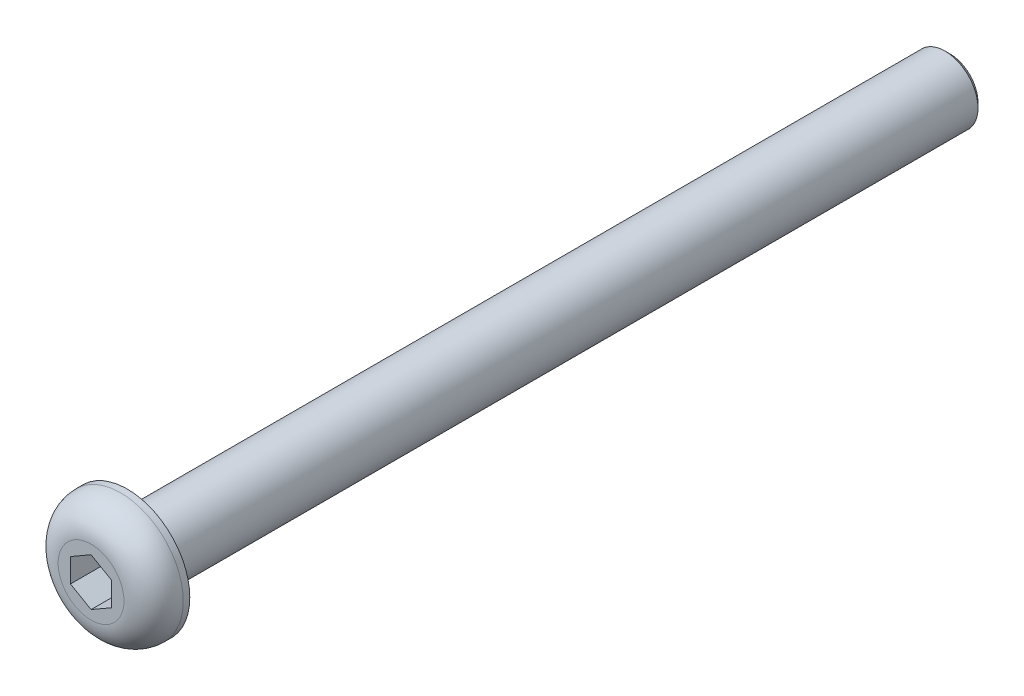
from build123d import *

# Parameters (mm, degrees)
SKETCH1_R           = 3.8
BOSS_EXTRUDE1_DEPTH = 2.2
SKETCH2_R           = 2
BOSS_EXTRUDE2_DEPTH = 50
CHAMFER1_SIZE       = 0.3
CUT_EXTRUDE1_DEPTH  = 2
FILLET1_R           = 1.8


with BuildPart() as part:
    # Sketch1 → Boss-Extrude1 (new body)
    with BuildSketch(Plane.XY):
        Circle(SKETCH1_R)
    extrude(amount=BOSS_EXTRUDE1_DEPTH)

    # Sketch2 → Boss-Extrude2 (add)
    with BuildSketch(Plane(origin=(0, 0, 0), x_dir=(-1, 0, 0), z_dir=(0, 0, -1))):
        with Locations(Location((0, 0, 0), (0, 0, 180))):
            Circle(SKETCH2_R)
    extrude(amount=BOSS_EXTRUDE2_DEPTH)

    # Chamfer1
    chamfer1_edges = [part.edges().sort_by_distance(p)[0] for p in [
        (-2, 0, -50),
    ]]
    chamfer(chamfer1_edges, length=CHAMFER1_SIZE)

    # Sketch3 → Cut-Extrude1 (cut)
    with BuildSketch(Plane.XY.offset(2.2)):
        Polygon((0, 1.443375673), (-1.25, 0.721687836), (-1.25, -0.721687836), (0, -1.443375673), (1.25, -0.721687836), (1.25, 0.721687836), align=None)
    extrude(amount=-CUT_EXTRUDE1_DEPTH, mode=Mode.SUBTRACT)

    # Fillet1
    fillet1_edges = [part.edges().sort_by_distance(p)[0] for p in [
        (-3.8, 0, 2.2),
    ]]
    fillet(fillet1_edges, radius=FILLET1_R)


solid = part.part
